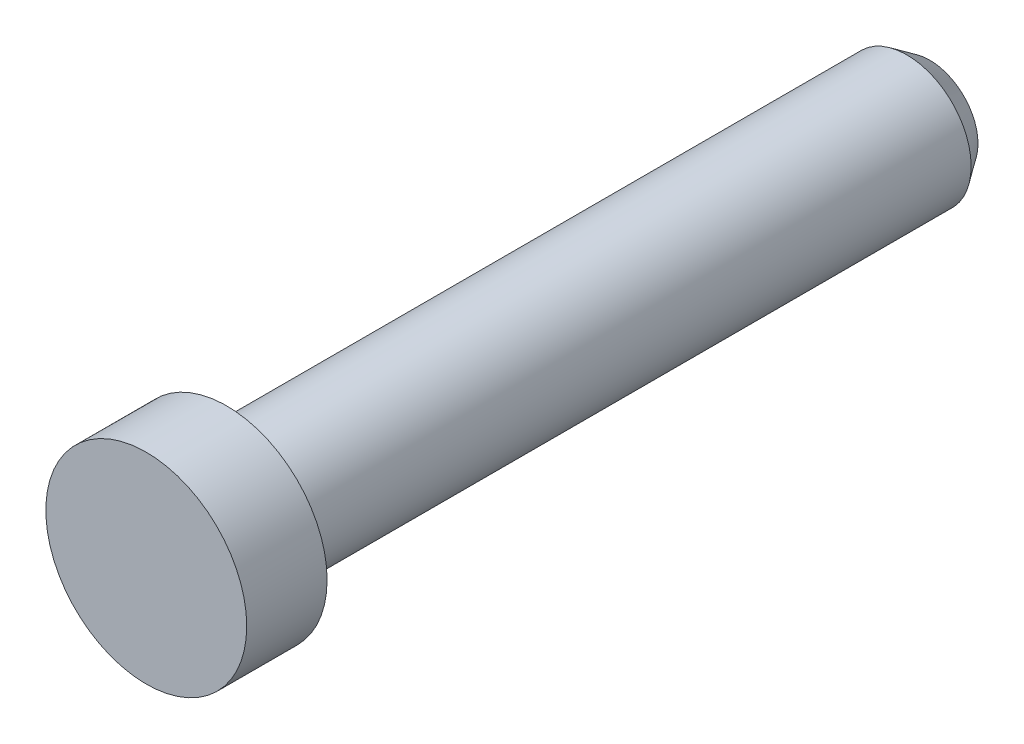
from build123d import *

# Parameters (mm, degrees)
SKETCH1_R           = 1.6
BOSS_EXTRUDE1_DEPTH = 8.75
CHAMFER1_SIZE       = 0.4
CHAMFER1_SIZE2      = 0.571259203
SKETCH2_R           = 2.5
BOSS_EXTRUDE2_DEPTH = 2


with BuildPart() as part:
    # Sketch1 → Boss-Extrude1 (new, symmetric)
    with BuildSketch(Plane.XY):
        Circle(SKETCH1_R)
    extrude(amount=BOSS_EXTRUDE1_DEPTH, both=True)

    # Chamfer1
    chamfer1_edges = [part.edges().sort_by_distance(p)[0] for p in [
        (-1.6, 0, -8.75),
    ]]
    chamfer1_side = [part.faces().sort_by_distance(p)[0] for p in [
        (0, 0, -8.75),
    ]]
    chamfer(chamfer1_edges, length=CHAMFER1_SIZE, length2=CHAMFER1_SIZE2, reference=chamfer1_side[0])

    # Sketch2 → Boss-Extrude2 (add)
    with BuildSketch(Plane.XY.offset(8.75)):
        Circle(SKETCH2_R)
    extrude(amount=BOSS_EXTRUDE2_DEPTH)


solid = part.part
